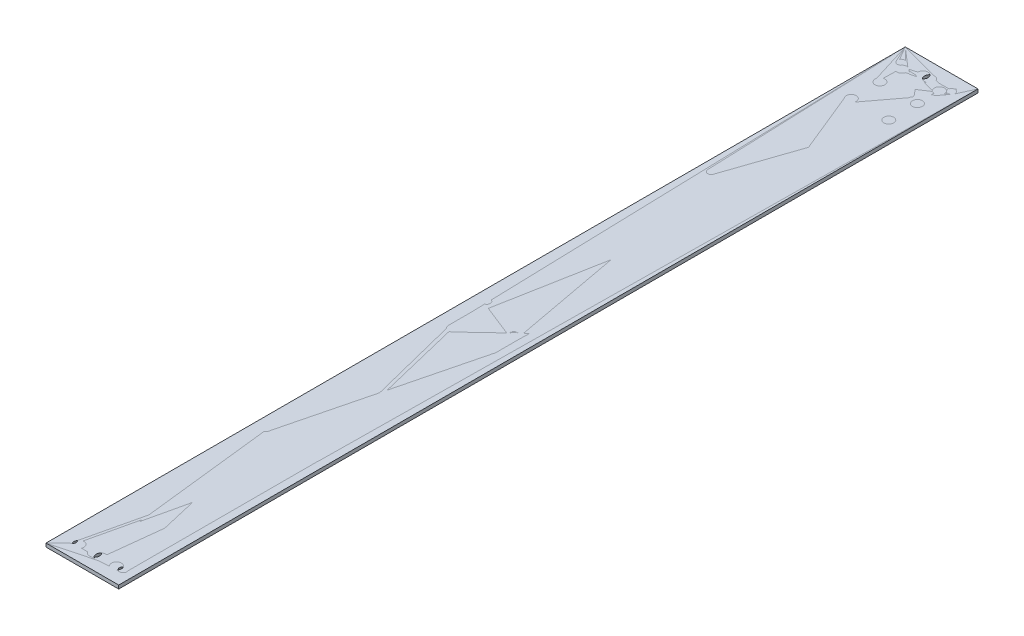
from build123d import *

# Parameters (mm, degrees)
SKETCH1_W             = 33
SKETCH1_H             = 390
BOSS_EXTRUDE1_DEPTH   = 1.5875
M4_CLEARANCE_HOLE1_D  = 4.5
M4X0_7_TAPPED_HOLE1_D = 3.3


with BuildPart() as part:
    # Sketch1 → Boss-Extrude1 (new body)
    with BuildSketch(Plane(origin=(0, 0, 0), x_dir=(1, 0, 0), z_dir=(0, 1, 0))):
        Rectangle(SKETCH1_W, SKETCH1_H)
    extrude(amount=BOSS_EXTRUDE1_DEPTH)

    # M4 Clearance Hole1 (through all)
    with Locations(Plane(origin=(0, 1.5875, 0), x_dir=(1, 0, 0), z_dir=(0, 1, 0))):
        with Locations((1.5, 188), (-8.5, 185.5), (-8.5, 175.5), (-8.5, 162.5), (-8.5, -7.5), (-8.5, -18), (-8.5, -188), (1.5, -188)):
            Hole(M4_CLEARANCE_HOLE1_D / 2)

    # M4x0.7 Tapped Hole1 (through all)
    with Locations(Plane(origin=(0, 1.5875, 0), x_dir=(1, 0, 0), z_dir=(0, 1, 0))):
        with Locations((11.5, 188), (11.5, -188), (11.5, -100), (11.5, 0), (11.5, 102), (11.5, 112)):
            Hole(M4X0_7_TAPPED_HOLE1_D / 2)


with BuildPart() as body_2:
    # Mirror1: mirrored copy
    add(part.part.mirror(Plane(origin=(0, 0, 0), x_dir=(0, 0, 1), z_dir=(1, 0, 0))))


solid = Compound([part.part, body_2.part])
